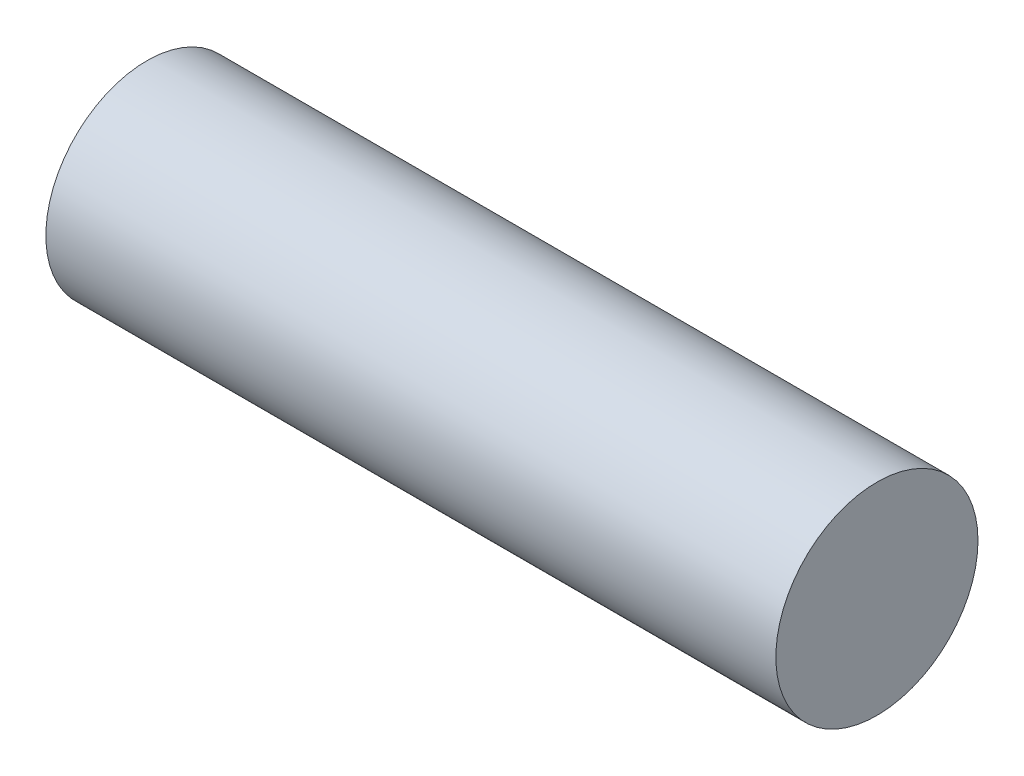
from build123d import *

# Parameters (mm, degrees)
SKETCH1_R           = 9
BOSS_EXTRUDE1_DEPTH = 65


with BuildPart() as part:
    # Sketch1 → Boss-Extrude1 (new body)
    with BuildSketch(Plane(origin=(0, 0, 0), x_dir=(0, 0, -1), z_dir=(1, 0, 0))):
        Circle(SKETCH1_R)
    extrude(amount=BOSS_EXTRUDE1_DEPTH)


solid = part.part
